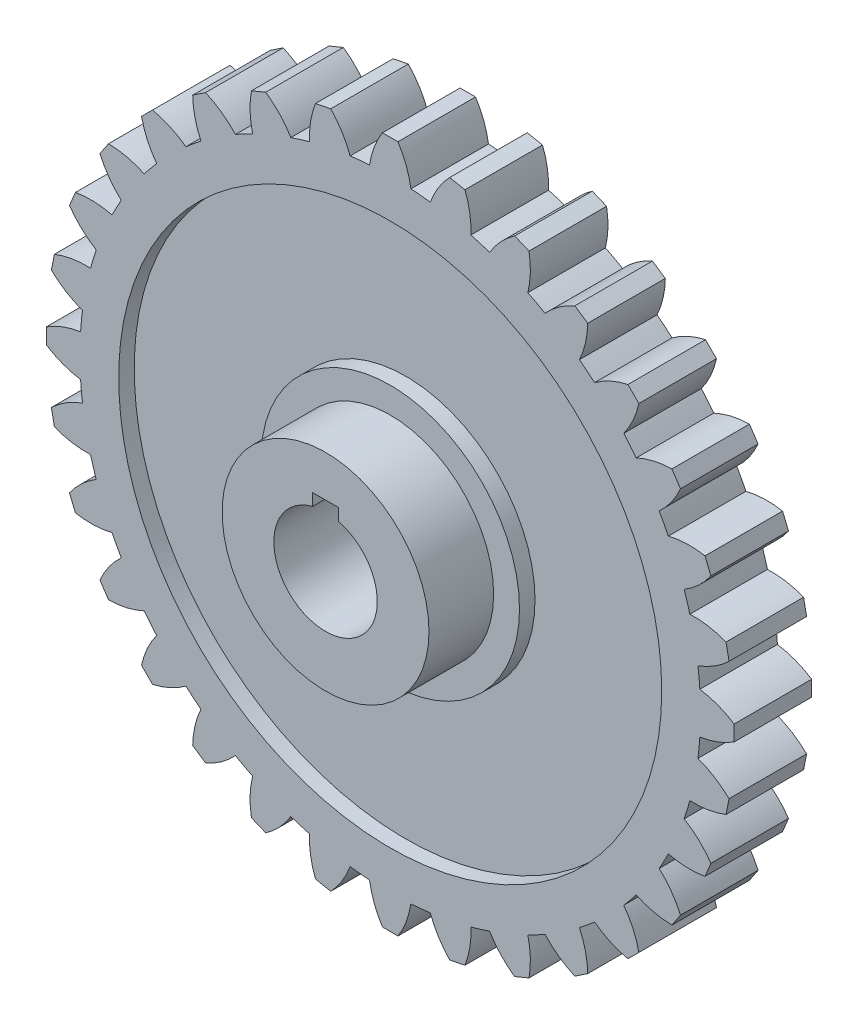
from build123d import *

# Parameters (mm, degrees)
SKETCH1_R               = 60
BOSS_EXTRUDE1_DEPTH     = 7.5
BOSS_EXTRUDE3_DEPTH     = 15
CIRPATTERN1_COUNT       = 32
SKETCH4_R               = 20
BOSS_EXTRUDE4_DEPTH     = 20
CUT_EXTRUDE1_DEPTH      = 103.198336581
CUT_EXTRUDE1_DEPTH_BACK = 103.198336581
CUT_EXTRUDE2_START      = 7.5
SKETCH6_R               = 52.5
SKETCH6_R_2             = 25
CUT_EXTRUDE2_DEPTH      = 3
CUT_EXTRUDE3_START      = -3
SKETCH7_R               = 52.5
SKETCH7_R_2             = 25
CUT_EXTRUDE3_DEPTH      = 3


with BuildPart() as part:
    # Sketch1 → Boss-Extrude1 (new, symmetric)
    with BuildSketch(Plane.XY):
        Circle(SKETCH1_R)
    extrude(amount=BOSS_EXTRUDE1_DEPTH, both=True)

    # Sketch2 → Boss-Extrude3 (add, through all)
    with BuildSketch(Plane.XY.offset(7.5)):
        with BuildLine():
            Line((1.5, 66.5), (-1.5, 66.5))
            ThreePointArc((-1.5, 66.5), (-3.099609074, 63.315018359), (-4, 59.866518188))
            ThreePointArc((-4, 59.866518188), (0, 60), (4, 59.866518188))
            ThreePointArc((4, 59.866518188), (3.099609074, 63.315018359), (1.5, 66.5))
        make_face()
    boss_extrude3 = extrude(amount=-BOSS_EXTRUDE3_DEPTH)

    # CirPattern1: Boss-Extrude3 ×32 about axis
    cirpattern1_axis = Axis((0, 0, 0), (0, 0, 1))
    for i in range(1, CIRPATTERN1_COUNT):
        add(boss_extrude3.rotate(cirpattern1_axis, i * 360 / CIRPATTERN1_COUNT))

    # Sketch4 → Boss-Extrude4 (add, symmetric)
    with BuildSketch(Plane.XY):
        Circle(SKETCH4_R)
    extrude(amount=BOSS_EXTRUDE4_DEPTH, both=True)

    # Sketch5 → Cut-Extrude1 (cut, two sides: drawn at the far end of the back side and taken through both)
    with BuildSketch(Plane.XY.offset(20).offset(-CUT_EXTRUDE1_DEPTH_BACK)):
        with BuildLine():
            Line((-2.5, 12), (2.5, 12))
            Line((2.5, 12), (2.5, 9.682458366))
            ThreePointArc((2.5, 9.682458366), (0, -10), (-2.5, 9.682458366))
            Line((-2.5, 9.682458366), (-2.5, 12))
        make_face()
    extrude(amount=CUT_EXTRUDE1_DEPTH + CUT_EXTRUDE1_DEPTH_BACK, mode=Mode.SUBTRACT)

    # Sketch6 → Cut-Extrude2 (cut)
    with BuildSketch(Plane.XY.offset(CUT_EXTRUDE2_START)):
        Circle(SKETCH6_R)
        Circle(SKETCH6_R_2, mode=Mode.SUBTRACT)
    extrude(amount=-CUT_EXTRUDE2_DEPTH, mode=Mode.SUBTRACT)

    # Sketch7 → Cut-Extrude3 (cut)
    with BuildSketch(Plane(origin=(0, 0, -7.5), x_dir=(-1, 0, 0), z_dir=(0, 0, -1)).offset(CUT_EXTRUDE3_START)):
        with Locations(Location((0, 0, 0), (0, 0, 180))):
            Circle(SKETCH7_R)
        with Locations(Location((0, 0, 0), (0, 0, 180))):
            Circle(SKETCH7_R_2, mode=Mode.SUBTRACT)
    extrude(amount=CUT_EXTRUDE3_DEPTH, mode=Mode.SUBTRACT)


solid = part.part
